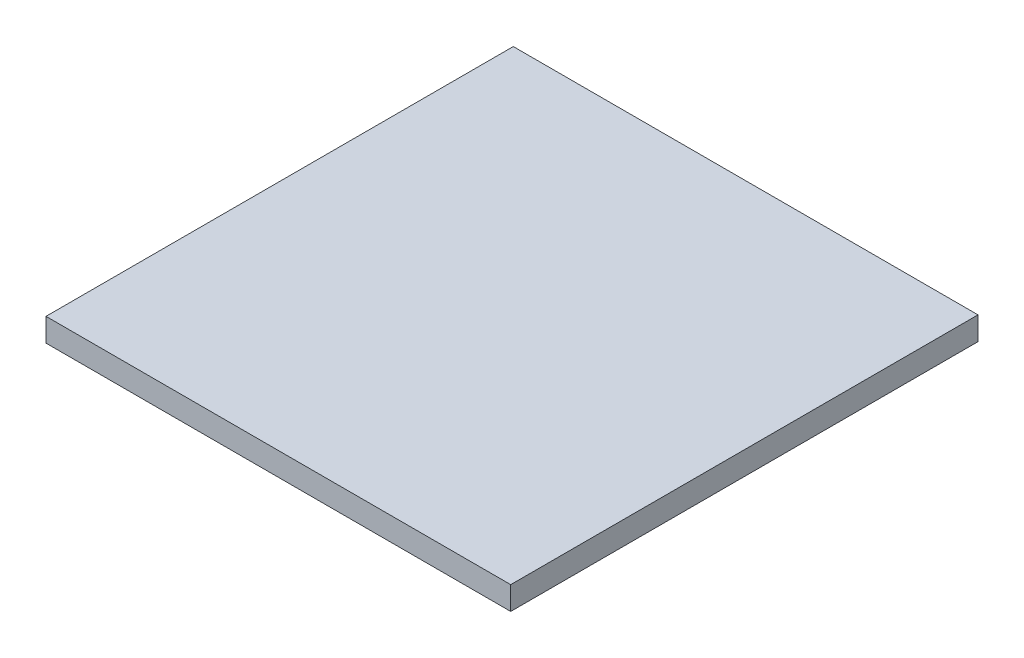
from build123d import *

# Parameters (mm, degrees)
CROQUIS1_W              = 360
CROQUIS1_H              = 362
SALIENTE_EXTRUIR1_DEPTH = 18


with BuildPart() as part:
    # Croquis1 → Saliente-Extruir1 (new body)
    with BuildSketch(Plane(origin=(0, 0, 0), x_dir=(1, 0, 0), z_dir=(0, 1, 0))):
        Rectangle(CROQUIS1_W, CROQUIS1_H)
    extrude(amount=SALIENTE_EXTRUIR1_DEPTH)


solid = part.part
